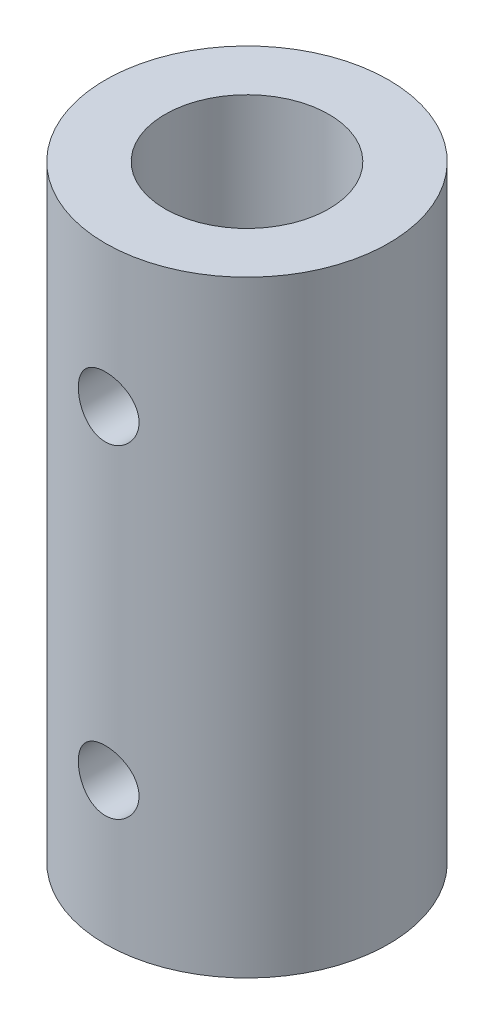
from build123d import *

# Parameters (mm, degrees)
SKETCH1_R               = 7
SKETCH1_R_2             = 4.05
BOSS_EXTRUDE1_DEPTH     = 15
BOSS_EXTRUDE2_START     = -15
SKETCH1_3_R             = 7
SKETCH1_3_R_2           = 1.7
BOSS_EXTRUDE2_DEPTH     = 15
CUT_EXTRUDE1_DEPTH      = 18.972200756
CUT_EXTRUDE1_DEPTH_BACK = 18.972200756
SKETCH2_R               = 1.5


with BuildPart() as part:
    # Sketch1 → Boss-Extrude1 (new body)
    with BuildSketch(Plane(origin=(0, 0, 0), x_dir=(1, 0, 0), z_dir=(0, 1, 0))):
        Circle(SKETCH1_R)
        Circle(SKETCH1_R_2, mode=Mode.SUBTRACT)
    extrude(amount=BOSS_EXTRUDE1_DEPTH)

    # Sketch1<3> → Boss-Extrude2 (add)
    with BuildSketch(Plane(origin=(0, 0, 0), x_dir=(1, 0, 0), z_dir=(0, 1, 0)).offset(BOSS_EXTRUDE2_START)):
        Circle(SKETCH1_3_R)
        Circle(SKETCH1_3_R_2, mode=Mode.SUBTRACT)
    extrude(amount=BOSS_EXTRUDE2_DEPTH)

    # Sketch2 → Cut-Extrude1 (cut, two sides: drawn at the far end of the back side and taken through both)
    with BuildSketch(Plane.XY.offset(-CUT_EXTRUDE1_DEPTH_BACK)):
        with Locations((0, 8)):
            Circle(SKETCH2_R)
        with Locations((0, -8)):
            Circle(SKETCH2_R)
    extrude(amount=CUT_EXTRUDE1_DEPTH + CUT_EXTRUDE1_DEPTH_BACK, mode=Mode.SUBTRACT)


solid = part.part
